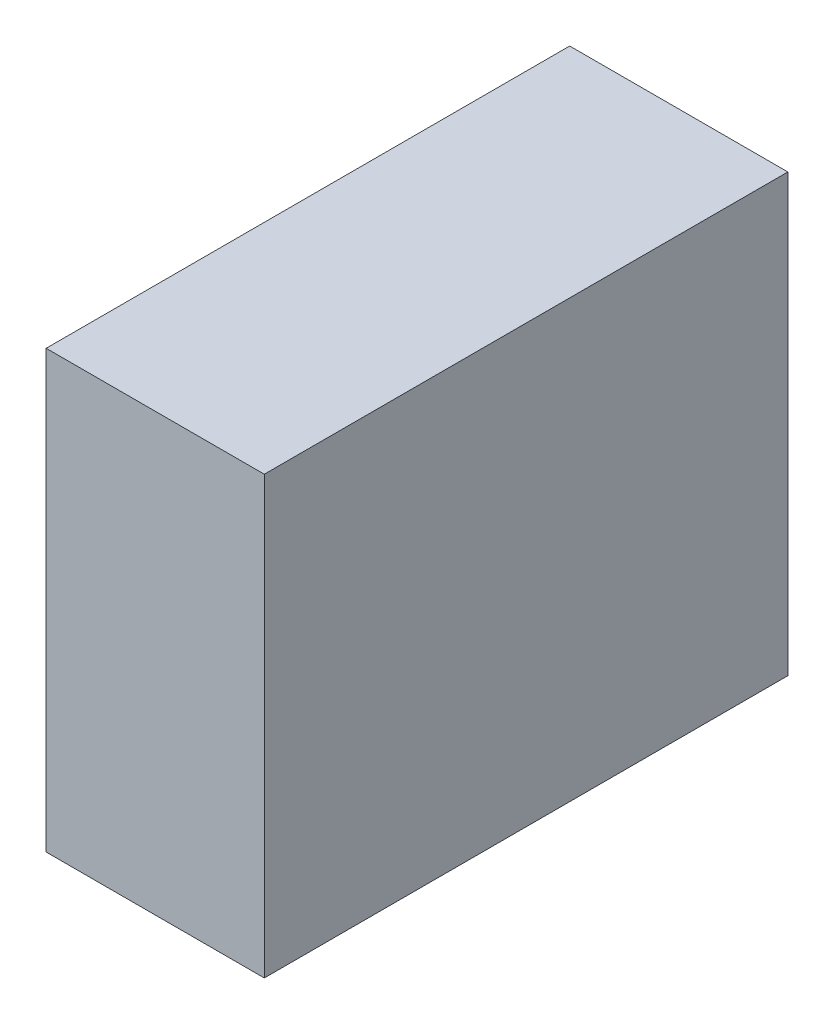
from build123d import *

# Parameters (mm, degrees)
PACK_PANO_STEP_SURUCU_1_START = -128
SKETCH1_W                     = 50
SKETCH1_H                     = 100
PACK_PANO_STEP_SURUCU_1_DEPTH = 120


with BuildPart() as part:
    # Sketch1 → PACK_pano_step_surucu_1 (new body)
    with BuildSketch(Plane.XY.offset(PACK_PANO_STEP_SURUCU_1_START)):
        with Locations((345, 230)):
            Rectangle(SKETCH1_W, SKETCH1_H)
    extrude(amount=-PACK_PANO_STEP_SURUCU_1_DEPTH)


solid = part.part
